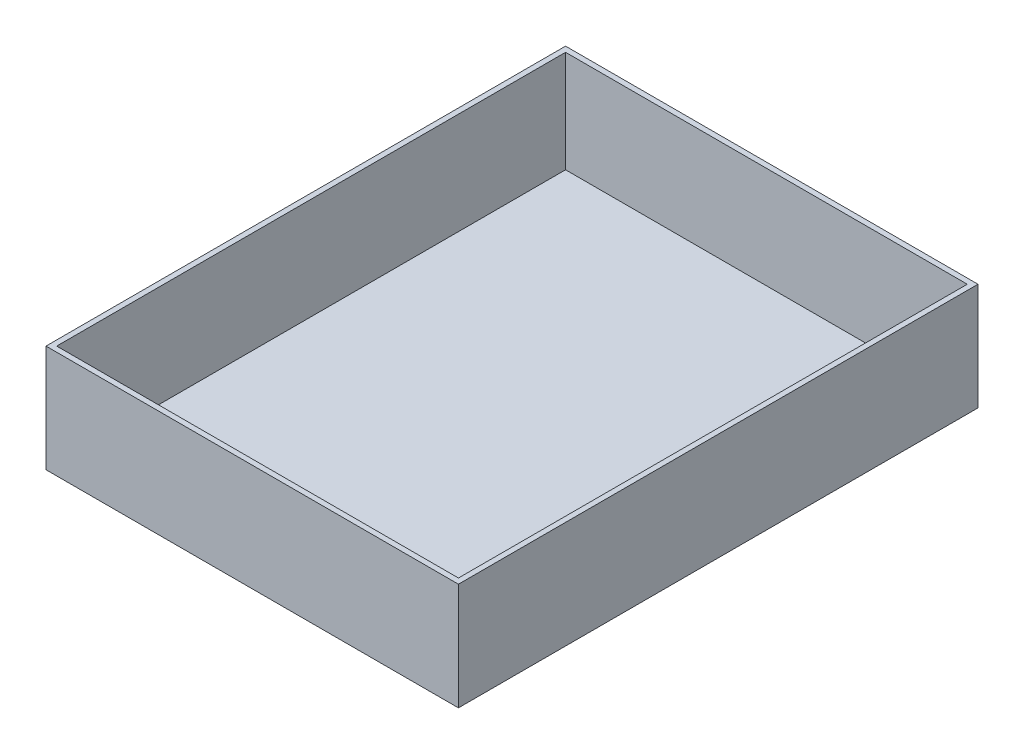
from build123d import *

# Parameters (mm, degrees)
SKETCH1_W           = 190.5
SKETCH1_H           = 241.3
BOSS_EXTRUDE1_DEPTH = 2.54
SKETCH2_W           = 195.58
SKETCH2_H           = 246.38
SKETCH2_W_2         = 190.5
SKETCH2_H_2         = 241.3
BOSS_EXTRUDE2_DEPTH = 50.8


with BuildPart() as part:
    # Sketch1 → Boss-Extrude1 (new body)
    with BuildSketch(Plane(origin=(0, 0, 0), x_dir=(1, 0, 0), z_dir=(0, 1, 0))):
        Rectangle(SKETCH1_W, SKETCH1_H)
    extrude(amount=BOSS_EXTRUDE1_DEPTH)

    # Sketch2 → Boss-Extrude2 (add)
    with BuildSketch(Plane.XZ):
        Rectangle(SKETCH2_W, SKETCH2_H)
        Rectangle(SKETCH2_W_2, SKETCH2_H_2, mode=Mode.SUBTRACT)
    extrude(amount=-BOSS_EXTRUDE2_DEPTH)


solid = part.part
